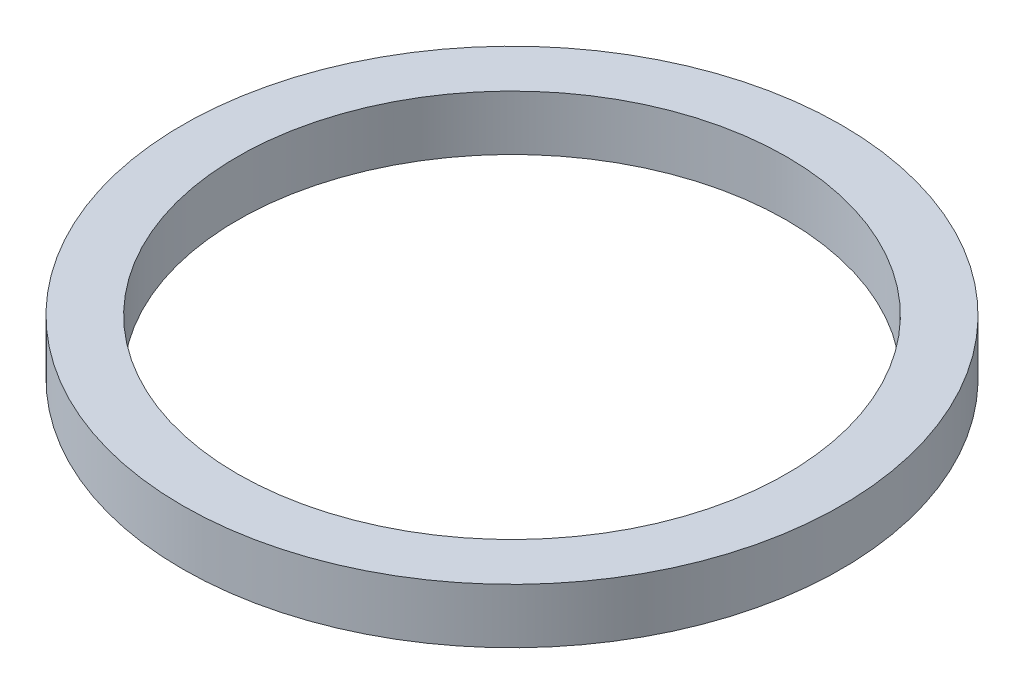
from build123d import *

# Parameters (mm, degrees)
SKETCH1_R           = 36
SKETCH1_R_2         = 30
BOSS_EXTRUDE1_DEPTH = 6


with BuildPart() as part:
    # Sketch1 → Boss-Extrude1 (new body)
    with BuildSketch(Plane(origin=(0, 0, 0), x_dir=(1, 0, 0), z_dir=(0, 1, 0))):
        with Locations(Location((0, 0, 0), (0, 0, 270))):
            Circle(SKETCH1_R)
        with Locations(Location((0, 0, 0), (0, 0, 270))):
            Circle(SKETCH1_R_2, mode=Mode.SUBTRACT)
    extrude(amount=BOSS_EXTRUDE1_DEPTH)


solid = part.part
